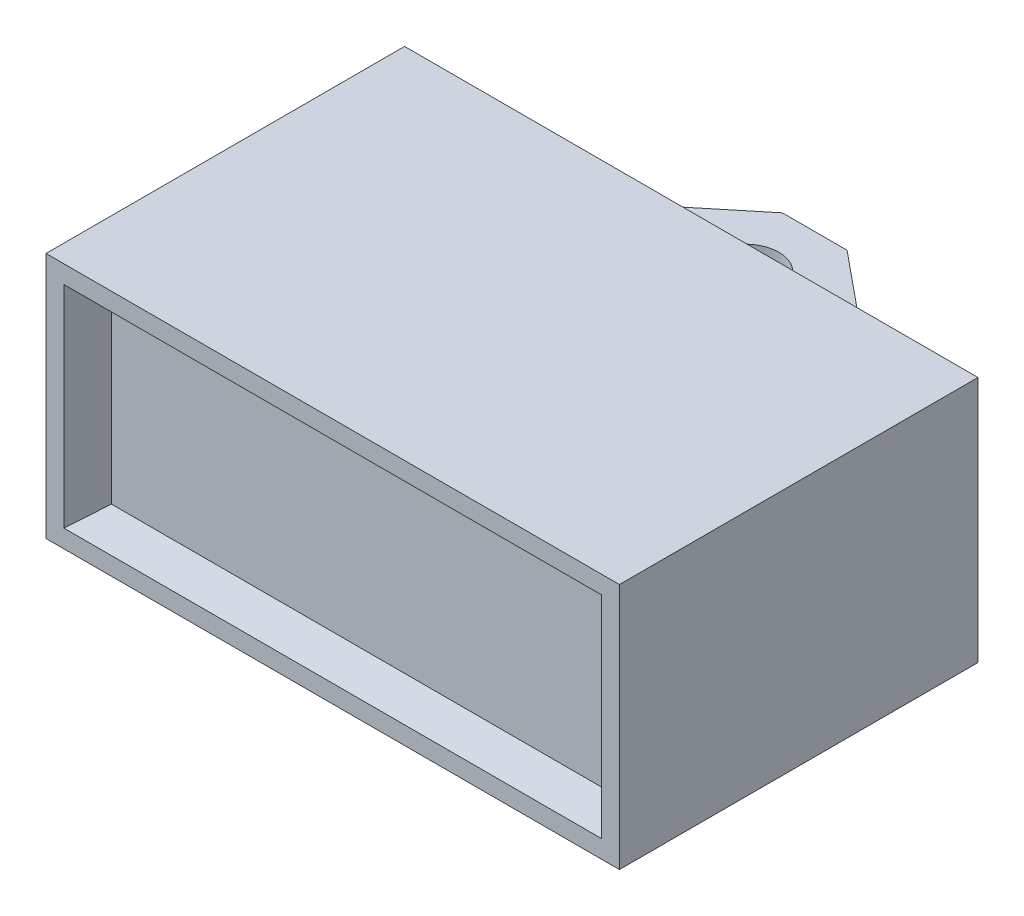
from build123d import *

# Parameters (mm, degrees)
SKETCH1_W           = 162.5727
SKETCH1_H           = 69.9897
BOSS_EXTRUDE1_DEPTH = 101.6635
SKETCH2_R           = 9.525
BOSS_EXTRUDE2_DEPTH = 69.9897
SKETCH3_W           = 34.9885
SKETCH3_H           = 22.29485
CUT_EXTRUDE1_DEPTH  = 1275.884686052
CUT_EXTRUDE2_DEPTH  = 27.432
CUT_EXTRUDE3_REACH  = 1269.087
CUT_EXTRUDE5_REACH  = 1269.087


with BuildPart() as part:
    # Sketch1 → Boss-Extrude1 (new body)
    with BuildSketch(Plane.XY):
        with Locations((634.389537826, 1225.388271401)):
            Rectangle(SKETCH1_W, SKETCH1_H)
    extrude(amount=BOSS_EXTRUDE1_DEPTH)

    # Sketch2 → Boss-Extrude2 (add, through all)
    with BuildSketch(Plane(origin=(0, 1260.383121401, 0), x_dir=(1, 0, 0), z_dir=(0, 1, 0))):
        Polygon((582.567187826, 0), (625.213787826, 34.9885), (643.565287826, 34.9885), (686.211887826, 0), align=None)
        with Locations(Location((634.389537826, 15.3035, 0), (0, 0, 270))):
            Circle(SKETCH2_R, mode=Mode.SUBTRACT)
    extrude(amount=-BOSS_EXTRUDE2_DEPTH)

    # Sketch3 → Cut-Extrude1 (cut, through all)
    with BuildSketch(Plane.ZY.offset(-553.103187826)):
        with Locations((-17.49425, 1201.540846401)):
            Rectangle(SKETCH3_W, SKETCH3_H)
        with Locations((-17.49425, 1249.235696401)):
            Rectangle(SKETCH3_W, SKETCH3_H)
    extrude(amount=-CUT_EXTRUDE1_DEPTH, mode=Mode.SUBTRACT)

    # Sketch5 → Cut-Extrude2 (cut, symmetric)
    with BuildSketch(Plane(origin=(0, 1225.388271401, 0), x_dir=(1, 0, 0), z_dir=(0, 1, 0))):
        Polygon((558.183187826, -101.6635), (561.485187826, -91.5035), (707.293887826, -91.5035), (710.595887826, -101.6635), align=None)
    extrude(amount=CUT_EXTRUDE2_DEPTH, both=True, mode=Mode.SUBTRACT)

    # Cut-Extrude3: up to this plane
    cut_extrude3_end = Plane(origin=(707.293887826, 1197.956271401, 91.5035), z_dir=(0.9510340687309474, 0, -0.3090860723375604))
    # Sketch6 → Cut-Extrude3 (cut, up to the surface)
    with BuildSketch(Plane.ZY.offset(-634.389537826), mode=Mode.PRIVATE) as cut_extrude3_sk1:
        Polygon((101.6635, 1255.303121401), (91.5035, 1252.820271401), (101.6635, 1252.820271401), align=None)
    cut_extrude3_tool1 = split(extrude(cut_extrude3_sk1.sketch, amount=-CUT_EXTRUDE3_REACH, mode=Mode.PRIVATE), bisect_by=cut_extrude3_end, keep=Keep.BOTH, mode=Mode.PRIVATE)
    add(cut_extrude3_tool1.solids().sort_by_distance((634.389538, 1253.647888, 98.276833))[0], mode=Mode.SUBTRACT)
    # Sketch6 → Cut-Extrude3 (cut, up to the surface)
    with BuildSketch(Plane.ZY.offset(-634.389537826), mode=Mode.PRIVATE) as cut_extrude3_sk2:
        Polygon((91.5035, 1197.956271401), (101.6635, 1195.473421401), (101.6635, 1197.956271401), align=None)
    cut_extrude3_tool2 = split(extrude(cut_extrude3_sk2.sketch, amount=-CUT_EXTRUDE3_REACH, mode=Mode.PRIVATE), bisect_by=cut_extrude3_end, keep=Keep.BOTH, mode=Mode.PRIVATE)
    add(cut_extrude3_tool2.solids().sort_by_distance((634.389538, 1197.128655, 98.276833))[0], mode=Mode.SUBTRACT)

    # Cut-Extrude5: up to this face of the body (flat: up to its plane)
    cut_extrude5_end = Plane(part.part.faces().sort_by_distance((559.834187826, 1225.388271401, 96.5835))[0])
    # Sketch8 → Cut-Extrude5 (cut, up to the picked face)
    with BuildSketch(Plane(origin=(634.389537826, 0, 0), x_dir=(0, 0, -1), z_dir=(1, 0, 0)), mode=Mode.PRIVATE) as cut_extrude5_sk1:
        Polygon((-101.6635, 1255.303121401), (-91.5035, 1252.820271401), (-91.5035, 1197.956271401), (-101.6635, 1195.473421401), align=None)
    cut_extrude5_tool1 = split(extrude(cut_extrude5_sk1.sketch, amount=-CUT_EXTRUDE5_REACH, mode=Mode.PRIVATE), bisect_by=cut_extrude5_end, keep=Keep.BOTH, mode=Mode.PRIVATE)
    add(cut_extrude5_tool1.solids().sort_by(Axis((634.389538, 1225.388271, 96.656813), (-1, 0, 0)))[0], mode=Mode.SUBTRACT)


solid = part.part
